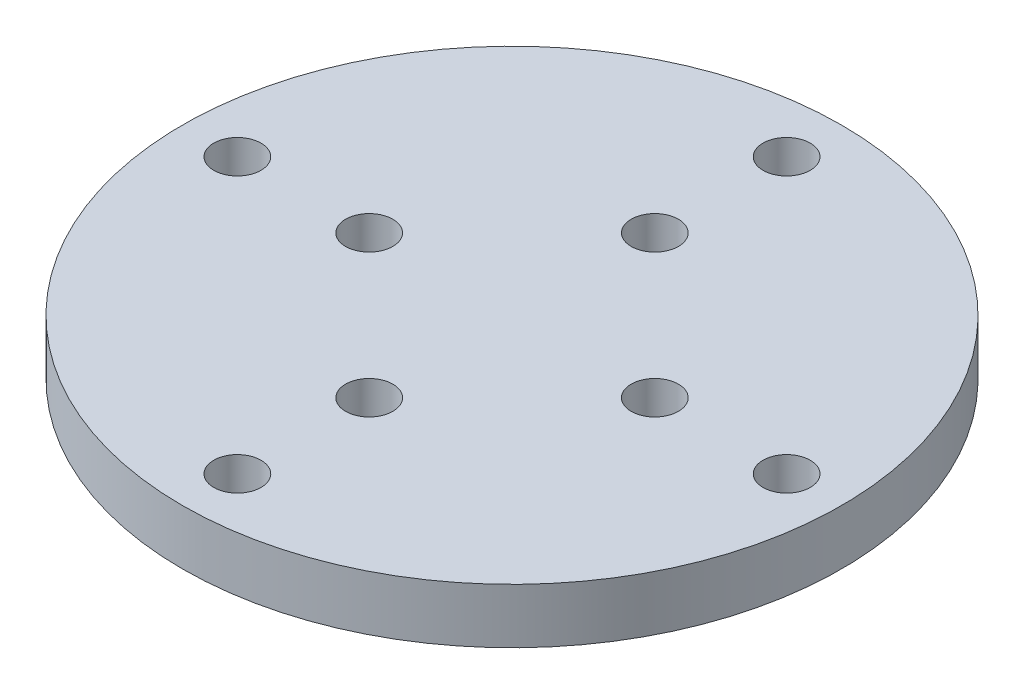
from build123d import *

# Parameters (mm, degrees)
SKETCH1_R            = 30
BOSS_EXTRUDE1_DEPTH  = 5
M4_CLEARANCE_HOLE1_D = 4.3
M4_CLEARANCE_HOLE2_D = 4.3


with BuildPart() as part:
    # Sketch1 → Boss-Extrude1 (new body)
    with BuildSketch(Plane(origin=(0, 0, 0), x_dir=(1, 0, 0), z_dir=(0, 1, 0))):
        with Locations(Location((0, 0, 0), (0, 0, 270))):
            Circle(SKETCH1_R)
    extrude(amount=BOSS_EXTRUDE1_DEPTH)

    # M4 Clearance Hole1 (through all)
    with Locations(Plane(origin=(0, 5, 0), x_dir=(1, 0, 0), z_dir=(0, 1, 0))):
        with Locations((0, -25), (-25, 0), (25, 0), (0, 25)):
            Hole(M4_CLEARANCE_HOLE1_D / 2)

    # M4 Clearance Hole2 (through all)
    with Locations(Plane(origin=(0, 5, 0), x_dir=(1, 0, 0), z_dir=(0, 1, 0))):
        with Locations((-13, 0), (13, 0), (0, 13), (0, -13)):
            Hole(M4_CLEARANCE_HOLE2_D / 2)


solid = part.part
